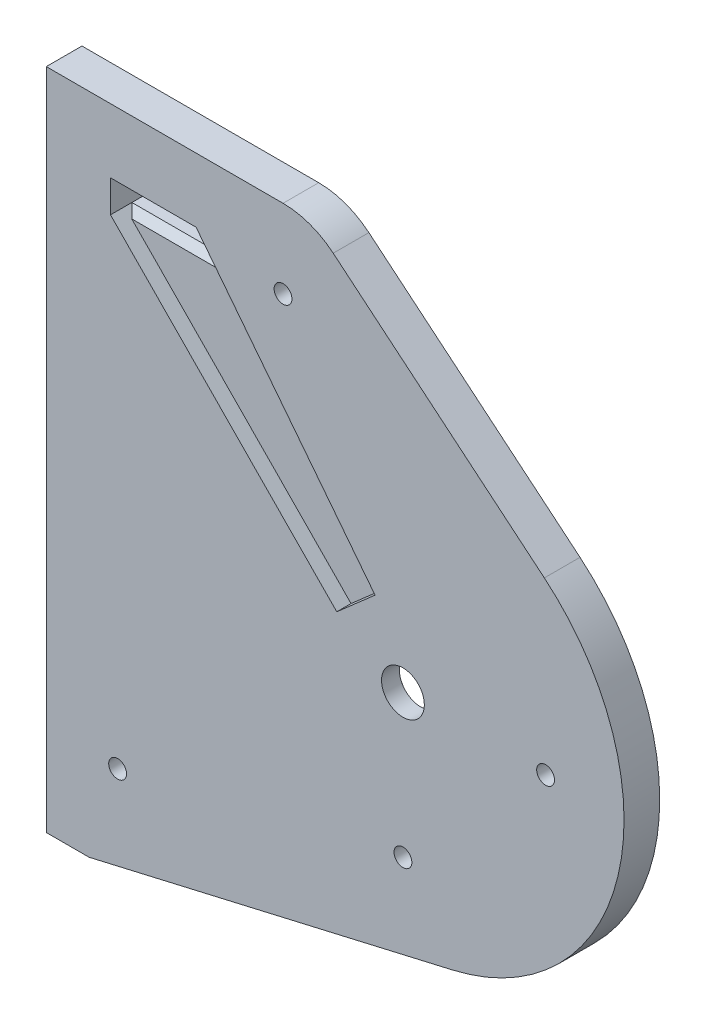
from build123d import *

# Parameters (mm, degrees)
SKETCH1_R           = 3
SKETCH1_R_2         = 1.25
SKETCH1_W           = 12
SKETCH1_H           = 4.5
BOSS_EXTRUDE1_DEPTH = 5
CUT_EXTRUDE1_DEPTH  = 2
CUT_EXTRUDE2_DEPTH  = 2.5
CHAMFER1_SIZE       = 1


with BuildPart() as part:
    # Sketch1 → Boss-Extrude1 (new body)
    with BuildSketch(Plane.XY):
        with BuildLine():
            Line((33.192050804, 21), (0, 21))
            Line((0, 21), (0, -72))
            Line((0, -72), (6, -72))
            Line((6, -72), (56.988314669, -60.202043939))
            ThreePointArc((56.988314669, -60.202043939), (80.160384186, -37.165976959), (69.826332353, -6.169000327))
            Line((69.826332353, -6.169000327), (40.227200994, 18.456161174))
            ThreePointArc((40.227200994, 18.456161174), (36.932520499, 20.344509967), (33.192050804, 21))
        make_face()
        with Locations((50, -30)):
            Circle(SKETCH1_R, mode=Mode.SUBTRACT)
        with Locations((70, -30)):
            Circle(SKETCH1_R_2, mode=Mode.SUBTRACT)
        with Locations((15, 9.75)):
            Rectangle(SKETCH1_W, SKETCH1_H, mode=Mode.SUBTRACT)
        with Locations((33.192050804, 10)):
            Circle(SKETCH1_R_2, mode=Mode.SUBTRACT)
        with Locations((10, -59.255419511)):
            Circle(SKETCH1_R_2, mode=Mode.SUBTRACT)
        with Locations((50, -50)):
            Circle(SKETCH1_R_2, mode=Mode.SUBTRACT)
    extrude(amount=BOSS_EXTRUDE1_DEPTH)

    # Sketch2 → Cut-Extrude1 (cut)
    with BuildSketch(Plane.XY.offset(5)):
        Polygon((9, 7.5), (40.725052348, -24.831204578), (46.094372356, -20.126440724), (21, 12), align=None)
    extrude(amount=-CUT_EXTRUDE1_DEPTH, mode=Mode.SUBTRACT)

    # Sketch3 → Cut-Extrude2 (cut)
    with BuildSketch(Plane(origin=(0, 0, 0), x_dir=(-1, 0, 0), z_dir=(0, 0, -1))):
        Polygon((-42.609916554, -30), (-46.304958277, -23.6), (-53.695041723, -23.6), (-57.390083446, -30), (-53.695041723, -36.4), (-46.304958277, -36.4), align=None)
    extrude(amount=-CUT_EXTRUDE2_DEPTH, mode=Mode.SUBTRACT)

    # Chamfer1
    chamfer1_edges = [part.edges().sort_by_distance(p)[0] for p in [
        (21, 9.75, 3),
        (15, 7.5, 3),
    ]]
    chamfer(chamfer1_edges, length=CHAMFER1_SIZE)


solid = part.part
